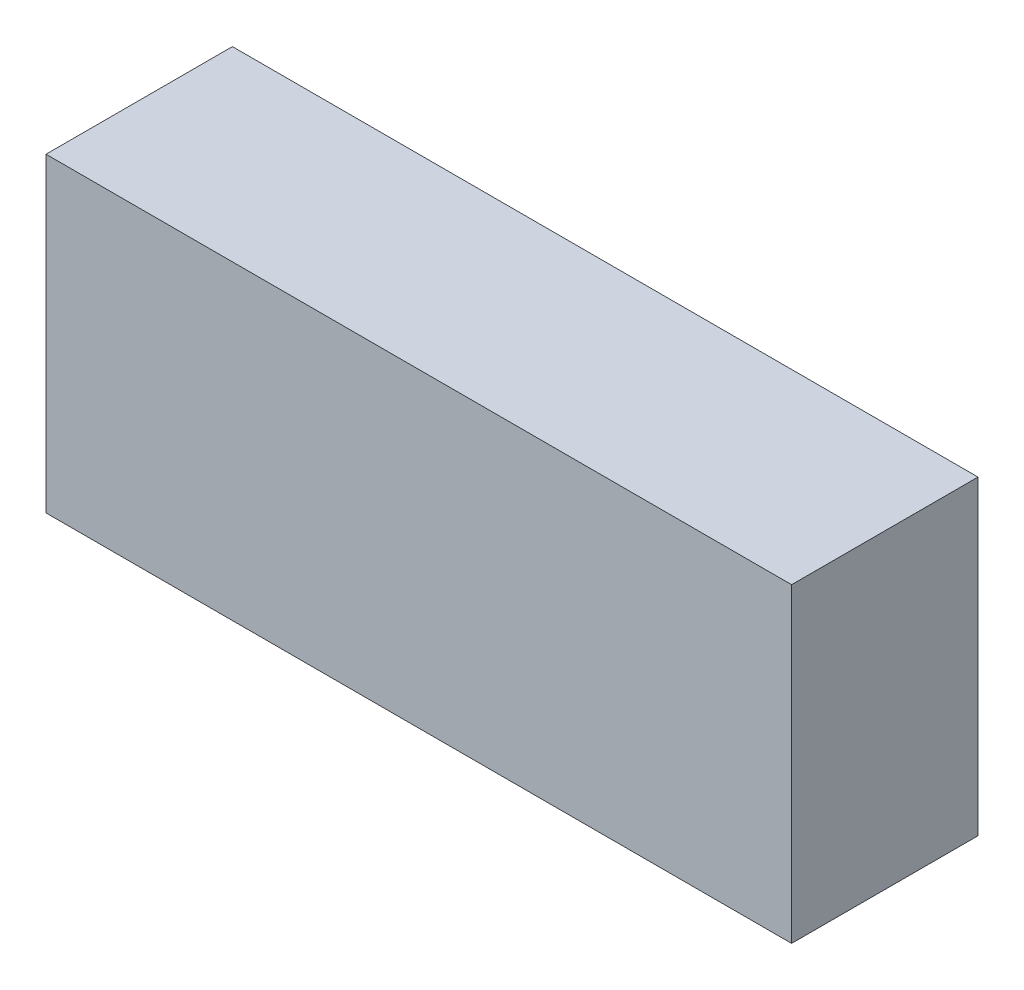
from build123d import *

# Parameters (mm, degrees)
SKETCH1_W           = 3
SKETCH1_H           = 5
BOSS_EXTRUDE1_DEPTH = 12


with BuildPart() as part:
    # Sketch1 → Boss-Extrude1 (new body)
    with BuildSketch(Plane(origin=(0, 0, 0), x_dir=(0, 0, -1), z_dir=(1, 0, 0))):
        with Locations((1.5, 2.5)):
            Rectangle(SKETCH1_W, SKETCH1_H)
    extrude(amount=BOSS_EXTRUDE1_DEPTH)


solid = part.part
